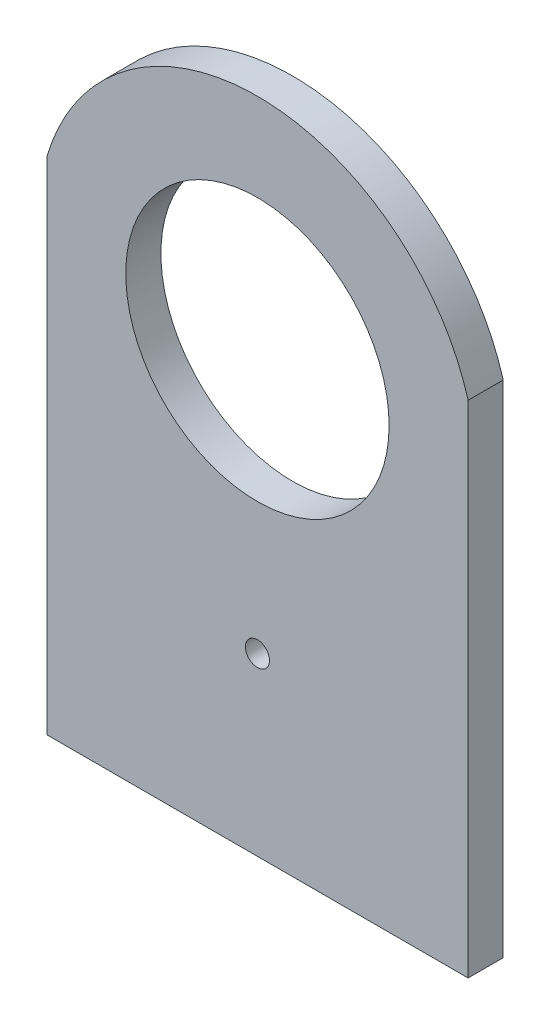
from build123d import *

# Parameters (mm, degrees)
SKETCH_1_R          = 30
EXTRUDE_1_DEPTH     = 8
SKETCH_2_R          = 2.75
CUT_EXTRUDE_1_DEPTH = 50
SKETCH_3_R          = 2.75
CUT_EXTRUDE_2_DEPTH = 20


with BuildPart() as part:
    # 草图1 → 凸台-拉伸1 (new body)
    with BuildSketch(Plane.XY):
        with BuildLine():
            Line((-48, 114), (-48, 0))
            Line((-48, 0), (48, 0))
            Line((48, 0), (48, 114))
            ThreePointArc((48, 114), (0, 150), (-48, 114))
        make_face()
        with Locations((0, 100)):
            Circle(SKETCH_1_R, mode=Mode.SUBTRACT)
    extrude(amount=EXTRUDE_1_DEPTH)

    # 草图2 → 切除-拉伸1 (cut)
    with BuildSketch(Plane.XZ):
        with Locations(Location((35, 4, 0), (0, 0, 270))):
            Circle(SKETCH_2_R)
        with Locations(Location((-35, 4, 0), (0, 0, 270))):
            Circle(SKETCH_2_R)
    extrude(amount=-CUT_EXTRUDE_1_DEPTH, mode=Mode.SUBTRACT)

    # 草图3 → 切除-拉伸2 (cut)
    with BuildSketch(Plane.XY.offset(8)):
        with Locations((0, 40)):
            Circle(SKETCH_3_R)
    extrude(amount=-CUT_EXTRUDE_2_DEPTH, mode=Mode.SUBTRACT)


solid = part.part
